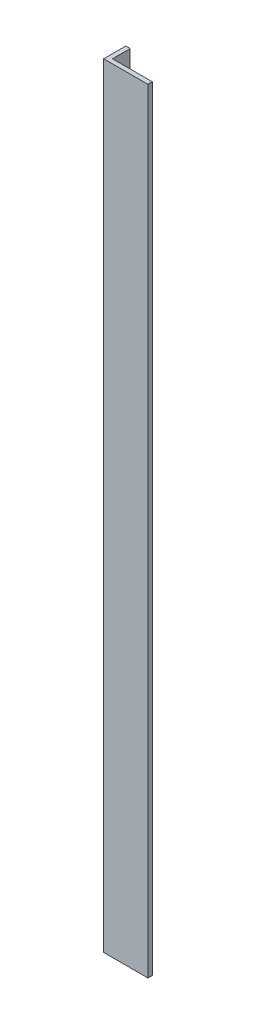
from build123d import *

# Parameters (mm, degrees)
BOSS_EXTRUDE1_DEPTH = 350


with BuildPart() as part:
    # Sketch1 → Boss-Extrude1 (new body)
    with BuildSketch(Plane(origin=(0, 0, 0), x_dir=(1, 0, 0), z_dir=(0, 1, 0))):
        Polygon((0, 0), (0, 10), (2, 10), (2, 2), (20, 2), (20, 0), align=None)
    extrude(amount=BOSS_EXTRUDE1_DEPTH)


solid = part.part
